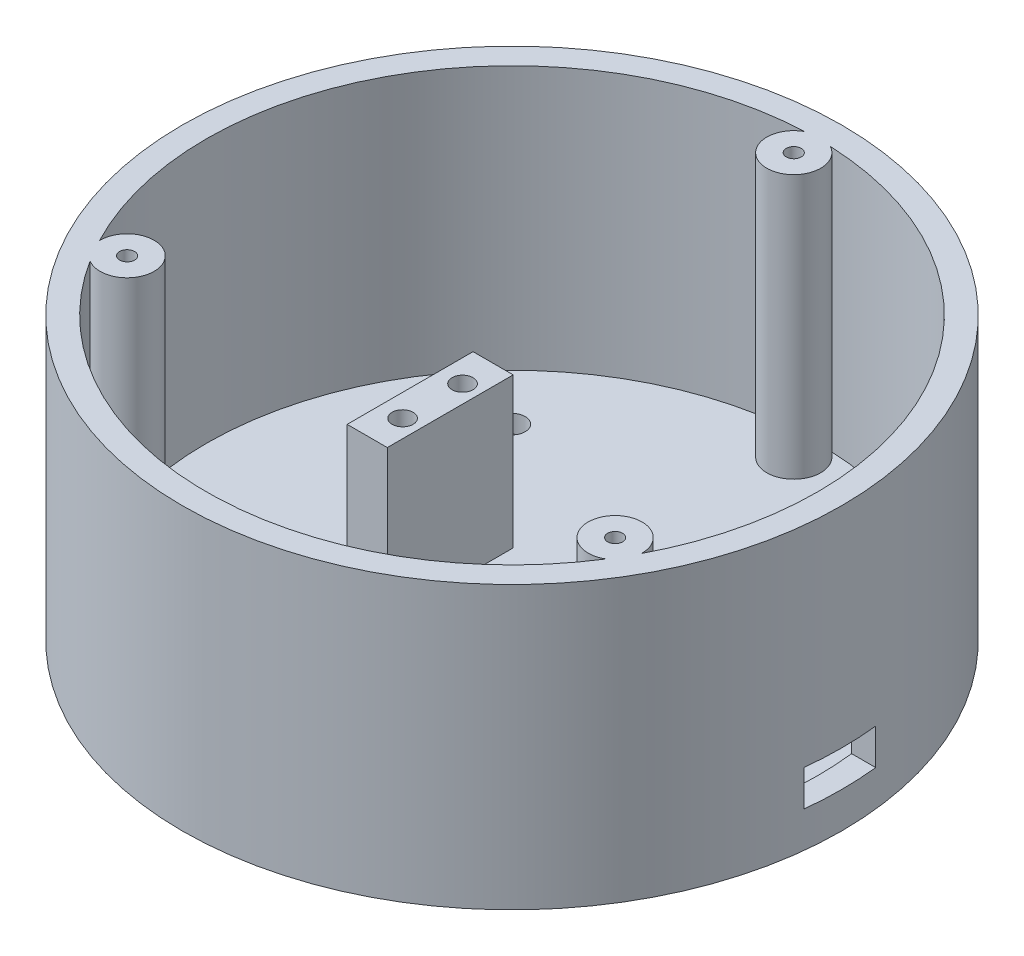
from build123d import *

# Parameters (mm, degrees)
SCHIZZO1_R                   = 55
ESTRUSIONE_ESTRUSIONE1_DEPTH = 47
SCHIZZO2_R                   = 51
TAGLIO_ESTRUSIONE1_DEPTH     = 44
SCHIZZO3_W                   = 6.7
SCHIZZO3_H                   = 21
ESTRUSIONE_ESTRUSIONE2_DEPTH = 25
SCHIZZO9_R                   = 1.75
TAGLIO_ESTRUSIONE2_DEPTH     = 12
TAGLIO_ESTRUSIONE3_START     = 45
SCHIZZO10_W                  = 12
SCHIZZO10_H                  = 6
TAGLIO_ESTRUSIONE3_DEPTH     = 67
SCHIZZO12_R                  = 2.2
TAGLIO_ESTRUSIONE4_DEPTH     = 90.364422451
SCHIZZO13_R                  = 4.5
ESTRUSIONE_ESTRUSIONE4_DEPTH = 44
SCHIZZO14_R                  = 1.25
TAGLIO_ESTRUSIONE6_DEPTH     = 12


with BuildPart() as part:
    # Schizzo1 → Estrusione-Estrusione1 (new body)
    with BuildSketch(Plane(origin=(0, 0, 0), x_dir=(1, 0, 0), z_dir=(0, 1, 0))):
        with Locations(Location((0, 0, 0), (0, 0, 270))):
            Circle(SCHIZZO1_R)
    extrude(amount=ESTRUSIONE_ESTRUSIONE1_DEPTH)

    # Schizzo2 → Taglio-Estrusione1 (cut)
    with BuildSketch(Plane(origin=(0, 47, 0), x_dir=(1, 0, 0), z_dir=(0, 1, 0))):
        with Locations(Location((0, 0, 0), (0, 0, 270))):
            Circle(SCHIZZO2_R)
    extrude(amount=-TAGLIO_ESTRUSIONE1_DEPTH, mode=Mode.SUBTRACT)

    # Schizzo3 → Estrusione-Estrusione2 (add)
    with BuildSketch(Plane(origin=(0, 3, 0), x_dir=(1, 0, 0), z_dir=(0, 1, 0))):
        with Locations((-13.65, 0)):
            Rectangle(SCHIZZO3_W, SCHIZZO3_H)
        with Locations((34.65, 0)):
            Rectangle(SCHIZZO3_W, SCHIZZO3_H)
    extrude(amount=ESTRUSIONE_ESTRUSIONE2_DEPTH)

    # Schizzo9 → Taglio-Estrusione2 (cut)
    with BuildSketch(Plane(origin=(0, 28, 0), x_dir=(1, 0, 0), z_dir=(0, 1, 0))):
        with Locations(Location((-13.25, 5, 0), (0, 0, 270))):
            Circle(SCHIZZO9_R)
        with Locations(Location((-13.25, -5, 0), (0, 0, 90))):
            Circle(SCHIZZO9_R)
        with Locations(Location((34.25, 5, 0), (0, 0, 270))):
            Circle(SCHIZZO9_R)
        with Locations(Location((34.25, -5, 0), (0, 0, 90))):
            Circle(SCHIZZO9_R)
    extrude(amount=-TAGLIO_ESTRUSIONE2_DEPTH, mode=Mode.SUBTRACT)

    # Schizzo10 → Taglio-Estrusione3 (cut)
    with BuildSketch(Plane(origin=(0, 0, 0), x_dir=(0, 0, -1), z_dir=(1, 0, 0)).offset(TAGLIO_ESTRUSIONE3_START)):
        with Locations((0, 9)):
            Rectangle(SCHIZZO10_W, SCHIZZO10_H)
    extrude(amount=TAGLIO_ESTRUSIONE3_DEPTH, mode=Mode.SUBTRACT)

    # Schizzo12 → Taglio-Estrusione4 (cut, through all)
    with BuildSketch(Plane(origin=(0, 3, 0), x_dir=(1, 0, 0), z_dir=(0, 1, 0))):
        with Locations(Location((-28.28, 28.28, 0), (0, 0, 270))):
            Circle(SCHIZZO12_R)
        with Locations(Location((28.28, 28.28, 0), (0, 0, 270))):
            Circle(SCHIZZO12_R)
        with Locations(Location((28.28, -28.28, 0), (0, 0, 270))):
            Circle(SCHIZZO12_R)
        with Locations(Location((-28.28, -28.28, 0), (0, 0, 270))):
            Circle(SCHIZZO12_R)
    extrude(amount=-TAGLIO_ESTRUSIONE4_DEPTH, mode=Mode.SUBTRACT)

    # Schizzo13 → Estrusione-Estrusione4 (add)
    with BuildSketch(Plane(origin=(0, 3, 0), x_dir=(1, 0, 0), z_dir=(0, 1, 0))):
        with Locations((0, 47)):
            Circle(SCHIZZO13_R)
        with Locations((40.703193978, -23.5)):
            Circle(SCHIZZO13_R)
        with Locations((-40.703193978, -23.5)):
            Circle(SCHIZZO13_R)
    extrude(amount=ESTRUSIONE_ESTRUSIONE4_DEPTH)

    # Schizzo14 → Taglio-Estrusione6 (cut)
    with BuildSketch(Plane(origin=(0, 47, 0), x_dir=(1, 0, 0), z_dir=(0, 1, 0))):
        with Locations(Location((0, 47, 0), (0, 0, 270))):
            Circle(SCHIZZO14_R)
        with Locations(Location((40.703193978, -23.5, 0), (0, 0, 270))):
            Circle(SCHIZZO14_R)
        with Locations(Location((-40.703193978, -23.5, 0), (0, 0, 270))):
            Circle(SCHIZZO14_R)
    extrude(amount=-TAGLIO_ESTRUSIONE6_DEPTH, mode=Mode.SUBTRACT)


solid = part.part
